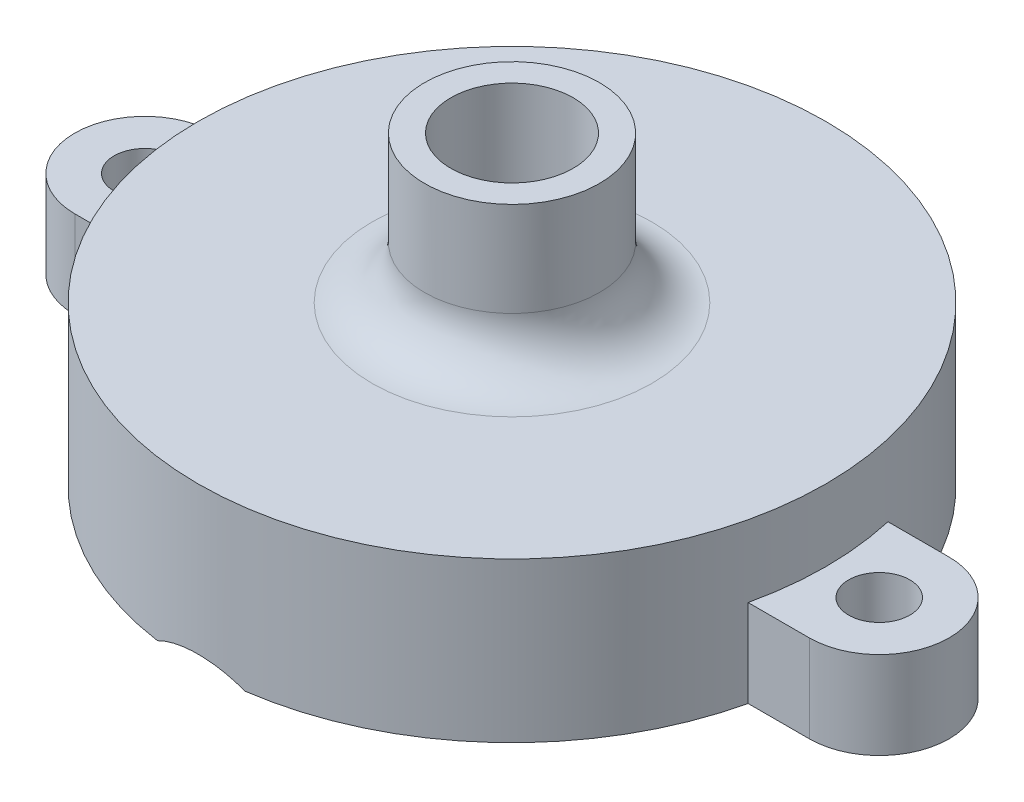
from build123d import *

# Parameters (mm, degrees)
FILLET1_R                = 3
BOSS_EXTRUDE4_REACH      = 44.135
BOSS_EXTRUDE4_END_RADIUS = 15.45
SKETCH3_W                = 7
SKETCH3_H                = 1.5
BOSS_EXTRUDE5_START      = -5
SKETCH4_R                = 1.75
BOSS_EXTRUDE5_DEPTH      = 5
CUT_EXTRUDE1_DEPTH       = 3.92
CUT_EXTRUDE1_DEPTH_BACK  = 3.19


with BuildPart() as part:
    # Sketch2 → Revolve1 (revolve)
    with BuildSketch(Plane.XY, mode=Mode.PRIVATE) as revolve1_sk:
        Polygon((3.5, 6), (15.45, 6), (15.45, 0), (16.65, 0), (16.65, -1.5), (17.95, -1.5), (17.95, 0), (17.95, 7.6), (5, 7.6), (5, 16), (3.5, 16), align=None)
    revolve(revolve1_sk.sketch.rotate(Axis((0, 0, 0), (0, 1, 0)), 90), axis=Axis((0, 0, 0), (0, 1, 0)))

    # Fillet1
    fillet1_edges = [part.edges().sort_by_distance(p)[0] for p in [
        (0, 7.6, 5),
    ]]
    fillet(fillet1_edges, radius=FILLET1_R)

    # Boss-Extrude4: up to this cylinder (the profile starts outside it)
    boss_extrude4_end = Plane(origin=(0, -0.75, 0), z_dir=(0, -1, 0)) * Cylinder(BOSS_EXTRUDE4_END_RADIUS, 120.17, mode=Mode.PRIVATE)
    # Sketch3 → Boss-Extrude4 (add, up to the surface)
    with BuildSketch(Plane(origin=(0, 0, 16.65), x_dir=(-1, 0, 0), z_dir=(0, 0, -1)), mode=Mode.PRIVATE) as boss_extrude4_sk1:
        with Locations((0, -0.75)):
            Rectangle(SKETCH3_W, SKETCH3_H)
    boss_extrude4_tool1 = extrude(boss_extrude4_sk1.sketch, amount=BOSS_EXTRUDE4_REACH, mode=Mode.PRIVATE) - boss_extrude4_end
    add(boss_extrude4_tool1.solids().sort_by_distance((0, -0.75, 16.65))[0])

    # Sketch4 → Boss-Extrude5 (add)
    with BuildSketch(Plane.XZ.offset(1.5).offset(BOSS_EXTRUDE5_START)):
        with BuildLine():
            Line((-21, -4), (-17.498642805, -4))
            ThreePointArc((-17.498642805, -4), (-17.95, 0), (-17.498642805, 4))
            Line((-17.498642805, 4), (-21, 4))
            ThreePointArc((-21, 4), (-25, 0), (-21, -4))
        make_face()
        with Locations(Location((-21, 0, 0), (0, 0, 270))):
            Circle(SKETCH4_R, mode=Mode.SUBTRACT)
    boss_extrude5 = extrude(amount=BOSS_EXTRUDE5_DEPTH)

    # Mirror1: Boss-Extrude5 across plane
    add(boss_extrude5.mirror(Plane(origin=(0, 0, 0), x_dir=(0, 0, 1), z_dir=(1, 0, 0))))

    # Sketch5 → Cut-Extrude1 (cut, two sides: drawn at the far end of the back side and taken through both)
    with BuildSketch(Plane(origin=(0, 0, 16.65), x_dir=(-1, 0, 0), z_dir=(0, 0, -1)).offset(-CUT_EXTRUDE1_DEPTH_BACK)):
        with BuildLine():
            Line((2.5, -1.5), (-2.5, -1.5))
            ThreePointArc((-2.5, -1.5), (0, -0.830127019), (2.5, -1.5))
        make_face()
    extrude(amount=CUT_EXTRUDE1_DEPTH + CUT_EXTRUDE1_DEPTH_BACK, mode=Mode.SUBTRACT)


solid = part.part
